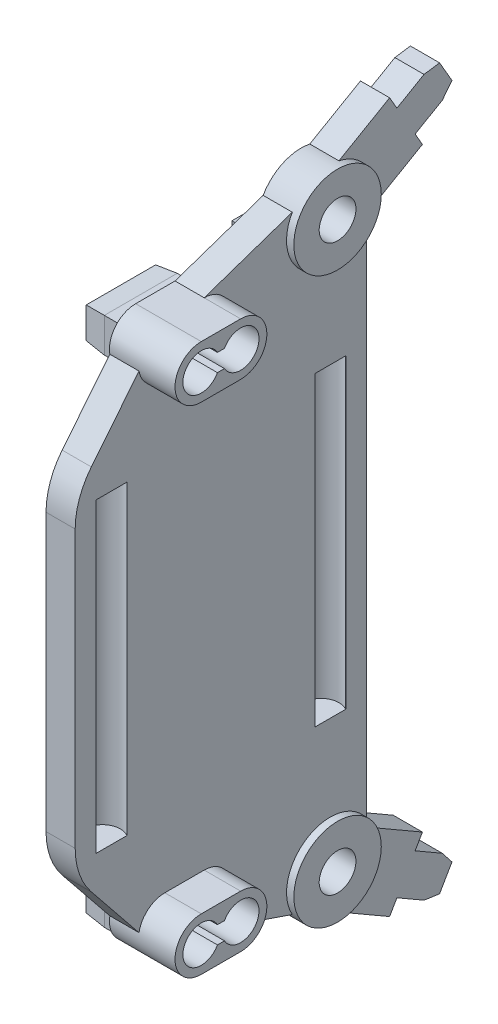
from build123d import *

# Parameters (mm, degrees)
DOWELSUPPORT_DEPTH          = 1.905
DOWELSUPPORT_DEPTH_BACK     = 1.27
SKETCH3_R                   = 3.81
SKETCH5_W                   = 6.35
SKETCH5_H                   = 28.575
SLIDERDOWELSUPPORT_DEPTH    = 1.27
SLIDERDOWELCUTOUT_DEPTH     = 13.335
CUT_EXTRUDE2_DEPTH          = 29.782824115
CUT_EXTRUDE2_DEPTH_BACK     = 29.782824115
SKETCH20_W                  = 1.27
SKETCH20_H                  = 12.7
LPATTERN1_COUNT             = 2
LPATTERN1_PITCH             = 19.05
LATERALSUPPORT_DEPTH        = 1.27
SKETCH8_W                   = 6.35
SKETCH8_H                   = 3
TABSUPPORT_DEPTH            = 1.27
STRINGDOWELSUPPORT_START    = -1.27
STRINGDOWELSUPPORT_DEPTH    = 5.715
INTERSUPPORT_DEPTH          = 1.27
SKETCH10_W                  = 6.35
SKETCH10_H                  = 3
TABBASE_DEPTH               = 1.27
SKETCH12_W                  = 6.35
SKETCH12_H                  = 3
TABDRAFT_DEPTH              = 1.73
TABDRAFT_DRAFT              = 5
TABDRAFT_PROFILE_2_DEPTH    = 1.73
TABDRAFT_PROFILE_2_DRAFT    = 5
STRINGDOWELHOLES_DEPTH      = 39.922670163
STRINGDOWELHOLES_DEPTH_BACK = 1.524
SKETCH14_R                  = 1.600000102
PULLEYDOWELHOLE_DEPTH       = 2.921
FILLET1_R                   = 6.35


with BuildPart() as part:
    # Sketch3 → DowelSupport (new, two sides: drawn at the far end of the back side and taken through both)
    with BuildSketch(Plane(origin=(0, 0, 0), x_dir=(0, 0, -1), z_dir=(1, 0, 0)).offset(-DOWELSUPPORT_DEPTH_BACK)):
        with Locations((0, 24.60625)):
            Circle(SKETCH3_R)
    extrude(amount=DOWELSUPPORT_DEPTH + DOWELSUPPORT_DEPTH_BACK)

    # Sketch8 → TabSupport (add, symmetric)
    with BuildSketch(Plane(origin=(0, 0, 0), x_dir=(0, 0, -1), z_dir=(1, 0, 0))):
        with Locations((0, 21.59)):
            Rectangle(SKETCH8_W, SKETCH8_H)
        with Locations((-12.7, 21.59)):
            Rectangle(SKETCH8_W, SKETCH8_H)
    extrude(amount=TABSUPPORT_DEPTH, both=True)


with BuildPart() as body_2:
    # Sketch5 → SliderDowelSupport (new, symmetric)
    with BuildSketch(Plane(origin=(0, 0, 0), x_dir=(0, 0, -1), z_dir=(1, 0, 0))):
        Rectangle(SKETCH5_W, SKETCH5_H)
    extrude(amount=SLIDERDOWELSUPPORT_DEPTH, both=True)

    # Sketch19 → SliderDowelCutout (cut, symmetric)
    with BuildSketch(Plane(origin=(0, 0, 0), x_dir=(1, 0, 0), z_dir=(0, 1, 0))):
        with BuildLine():
            Line((1.27, 1.350000094), (1.243577144, 1.350000094))
            ThreePointArc((1.243577144, 1.350000094), (-1.068, 0), (1.243577144, -1.350000094))
            Line((1.243577144, -1.350000094), (1.27, -1.350000094))
            Line((1.27, -1.350000094), (1.27, 1.350000094))
        make_face()
    extrude(amount=SLIDERDOWELCUTOUT_DEPTH, both=True, mode=Mode.SUBTRACT)

    # Sketch20 → Cut-Extrude2 (cut, two sides: drawn at the far end of the back side and taken through both)
    with BuildSketch(Plane(origin=(1.27, 0, 0), x_dir=(0, 0, -1), z_dir=(1, 0, 0)).offset(-CUT_EXTRUDE2_DEPTH_BACK)):
        Rectangle(SKETCH20_W, SKETCH20_H)
    extrude(amount=CUT_EXTRUDE2_DEPTH + CUT_EXTRUDE2_DEPTH_BACK, mode=Mode.SUBTRACT)


with BuildPart() as lpattern1_1:
    # LPattern1: pattern copy
    add(body_2.part.moved(Location(Vector(0, 0, 1) * (1 * LPATTERN1_PITCH))))


with BuildPart() as body_4:
    # Sketch6 → LateralSupport (new, symmetric)
    with BuildSketch(Plane(origin=(0, 0, 0), x_dir=(0, 0, -1), z_dir=(1, 0, 0))):
        Polygon((7.392863577, 27.041434671), (5.805363577, 29.791065329), (8.169612929, 31.156065329), (9.523465192, 31.351124423), (10.602965192, 29.481375577), (9.757112929, 28.406434671), align=None)
    extrude(amount=LATERALSUPPORT_DEPTH, both=True)


with BuildPart() as tabsupport_piece_1:
    # of the separate pieces the step leaves, piece 1, a body of its own (tabsupport_pieces)
    add(part.part.solids().sort_by_distance((0, 24.60625, -3.81))[0])


with BuildPart() as tabsupport_piece_2:
    # of the separate pieces the step leaves, piece 2, a body of its own (tabsupport_pieces)
    add(part.part.solids().sort_by_distance((-1.27, 20.09, 9.525))[0])

    # Sketch15 → StringDowelSupport (add)
    with BuildSketch(Plane(origin=(0, 0, 0), x_dir=(0, 0, -1), z_dir=(1, 0, 0)).offset(STRINGDOWELSUPPORT_START)):
        with BuildLine():
            Line((-14.4145, 23.876), (-10.9855, 23.876))
            ThreePointArc((-10.9855, 23.876), (-8.6995, 21.59), (-10.9855, 19.304))
            Line((-10.9855, 19.304), (-14.4145, 19.304))
            ThreePointArc((-14.4145, 19.304), (-16.7005, 21.59), (-14.4145, 23.876))
        make_face()
    extrude(amount=STRINGDOWELSUPPORT_DEPTH)


with BuildPart() as body_2_1:
    add(body_2.part)

    add(lpattern1_1.part)  # InterSupport merges LPattern1_1

    add(body_4.part)  # InterSupport merges body 4

    add(tabsupport_piece_1.part)  # InterSupport merges TabSupport piece 1

    add(tabsupport_piece_2.part)  # InterSupport merges TabSupport piece 2
    # Sketch7 → InterSupport (add, symmetric)
    with BuildSketch(Plane(origin=(0, 0, 0), x_dir=(0, 0, -1), z_dir=(1, 0, 0))):
        Polygon((8.027863577, 25.941582409), (5.170363577, 30.890917591), (-1.187110053, 27.22042848), (-0.923046602, 27.310559749), (0, 24.60625), (1.42875, 22.131582409), align=None)
        Polygon((-1.42875, 27.080917591), (-1.187110053, 27.22042848), (-10.9855, 23.876), (-14.4145, 23.876), (-15.582507886, 22.531146949), (-22.225, 14.2875), (-15.875, 14.2875), (-15.875, 0), (-3.175, 0), (-3.175, 14.2875), (3.175, 14.2875), (3.175, 20.09), (0.923046602, 21.901940251), (0, 24.60625), align=None)
    extrude(amount=INTERSUPPORT_DEPTH, both=True)

    # Sketch10 → TabBase (add)
    with BuildSketch(Plane.ZY.offset(1.27)):
        with Locations((0, 21.59)):
            Rectangle(SKETCH10_W, SKETCH10_H)
        with Locations((12.7, 21.59)):
            Rectangle(SKETCH10_W, SKETCH10_H)
    extrude(amount=TABBASE_DEPTH)


with BuildPart() as tabdraft_tool:
    # Sketch12 → TabDraft (with draft: the straight prism first)
    with BuildSketch(Plane.ZY.offset(2.54)):
        with Locations((0, 21.59)):
            Rectangle(SKETCH12_W, SKETCH12_H)
    extrude(amount=TABDRAFT_DEPTH)
    # TabDraft: the draft: its side faces are tilted about the plane it starts from
    tabdraft_sides = [tabdraft_tool.faces().sort_by_distance(p)[0] for p in [
        (-3.405, 21.59, 3.175),
        (-3.405, 23.09, 0),
        (-3.405, 21.59, -3.175),
        (-3.405, 20.09, 0),
    ]]
    draft(tabdraft_sides, Plane.ZY.offset(2.54), TABDRAFT_DRAFT)


with BuildPart() as body_2_2:
    add(body_2_1.part)

    # TabDraft: add tabdraft_tool
    add(tabdraft_tool.part)


with BuildPart() as tabdraft_profile_2_tool:
    # Sketch12 → TabDraft profile 2 (with draft: the straight prism first)
    with BuildSketch(Plane.ZY.offset(2.54)):
        with Locations((12.7, 21.59)):
            Rectangle(SKETCH12_W, SKETCH12_H)
    extrude(amount=TABDRAFT_PROFILE_2_DEPTH)
    # TabDraft profile 2: the draft: its side faces are tilted about the plane it starts from
    tabdraft_profile_2_sides = [tabdraft_profile_2_tool.faces().sort_by_distance(p)[0] for p in [
        (-3.405, 21.59, 9.525),
        (-3.405, 20.09, 12.7),
        (-3.405, 21.59, 15.875),
        (-3.405, 23.09, 12.7),
    ]]
    draft(tabdraft_profile_2_sides, Plane.ZY.offset(2.54), TABDRAFT_PROFILE_2_DRAFT)


with BuildPart() as body_2_3:
    add(body_2_2.part)

    # TabDraft profile 2: add tabdraft_profile_2_tool
    add(tabdraft_profile_2_tool.part)

    # Sketch16 → StringDowelHoles (cut, two sides: drawn at the far end of the back side and taken through both)
    with BuildSketch(Plane(origin=(1.905, 0, 0), x_dir=(0, 0, -1), z_dir=(1, 0, 0)).offset(-STRINGDOWELHOLES_DEPTH_BACK)):
        with BuildLine():
            Line((-13.00760401, 20.828), (-12.39239599, 20.828))
            ThreePointArc((-12.39239599, 20.828), (-9.385499898, 21.59), (-12.39239599, 22.352))
            Line((-12.39239599, 22.352), (-13.00760401, 22.352))
            ThreePointArc((-13.00760401, 22.352), (-16.014500102, 21.59), (-13.00760401, 20.828))
        make_face()
    extrude(amount=STRINGDOWELHOLES_DEPTH + STRINGDOWELHOLES_DEPTH_BACK, mode=Mode.SUBTRACT)

    # Sketch14 → PulleyDowelHole (cut)
    with BuildSketch(Plane(origin=(1.905, 0, 0), x_dir=(0, 0, -1), z_dir=(1, 0, 0))):
        with Locations((0, 24.60625)):
            Circle(SKETCH14_R)
    extrude(amount=-PULLEYDOWELHOLE_DEPTH, mode=Mode.SUBTRACT)

    # Mirror1: body 2 across plane


with BuildPart() as body_2_4:
    add(body_2_3.part)
    add(body_2_3.part.mirror(Plane.ZX))

    # Fillet1
    fillet1_edges = [body_2_4.edges().sort_by_distance(p)[0] for p in [
        (0, -14.2875, 22.225),
        (0, 14.2875, 22.225),
    ]]
    fillet(fillet1_edges, radius=FILLET1_R)


solid = body_2_4.part
